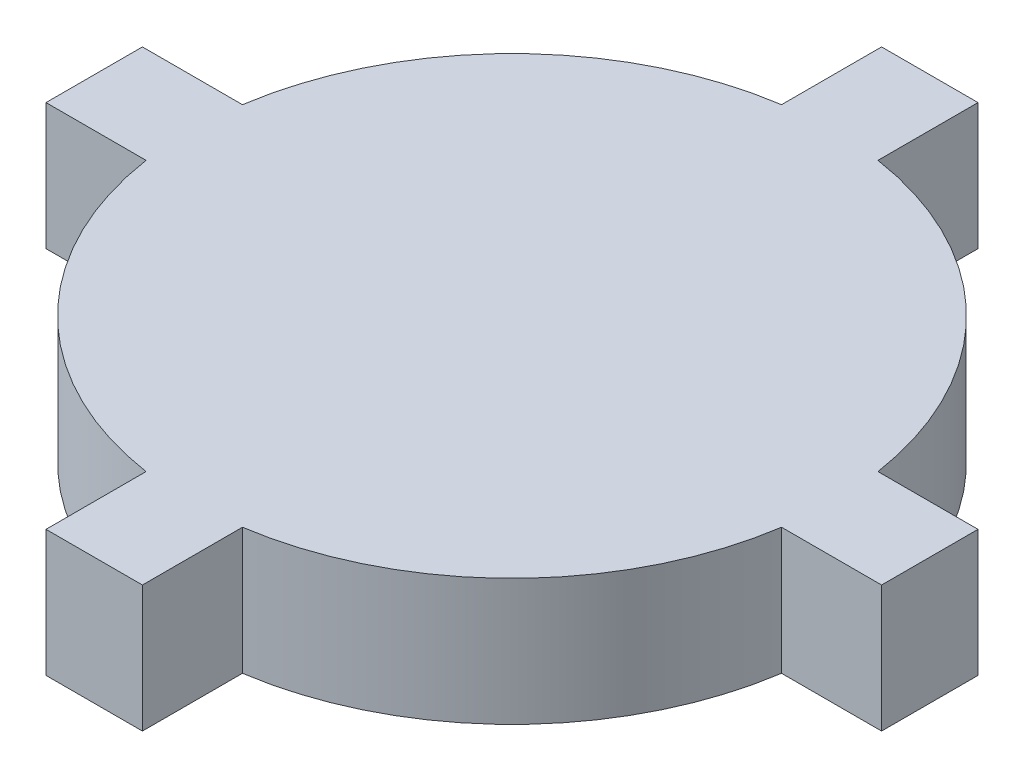
from build123d import *

# Parameters (mm, degrees)
BOSS_EXTRUDE1_DEPTH = 5


with BuildPart() as part:
    # Sketch1 → Boss-Extrude1 (new body)
    with BuildSketch(Plane(origin=(0, 0, 0), x_dir=(1, 0, 0), z_dir=(0, 1, 0))):
        with BuildLine():
            Line((16.51, -1.905), (16.51, 1.905))
            Line((16.51, 1.905), (12.556312158, 1.905))
            ThreePointArc((12.556312158, 1.905), (8.980256121, 8.980256121), (1.905, 12.556312158))
            Line((1.905, 12.556312158), (1.905, 16.51))
            Line((1.905, 16.51), (-1.905, 16.51))
            Line((-1.905, 16.51), (-1.905, 12.556312158))
            ThreePointArc((-1.905, 12.556312158), (-8.980256121, 8.980256121), (-12.556312158, 1.905))
            Line((-12.556312158, 1.905), (-16.51, 1.905))
            Line((-16.51, 1.905), (-16.51, -1.905))
            Line((-16.51, -1.905), (-12.556312158, -1.905))
            ThreePointArc((-12.556312158, -1.905), (-8.980256121, -8.980256121), (-1.905, -12.556312158))
            Line((-1.905, -12.556312158), (-1.905, -16.51))
            Line((-1.905, -16.51), (1.905, -16.51))
            Line((1.905, -16.51), (1.905, -12.556312158))
            ThreePointArc((1.905, -12.556312158), (8.980256121, -8.980256121), (12.556312158, -1.905))
            Line((12.556312158, -1.905), (16.51, -1.905))
        make_face()
    extrude(amount=BOSS_EXTRUDE1_DEPTH)


solid = part.part
